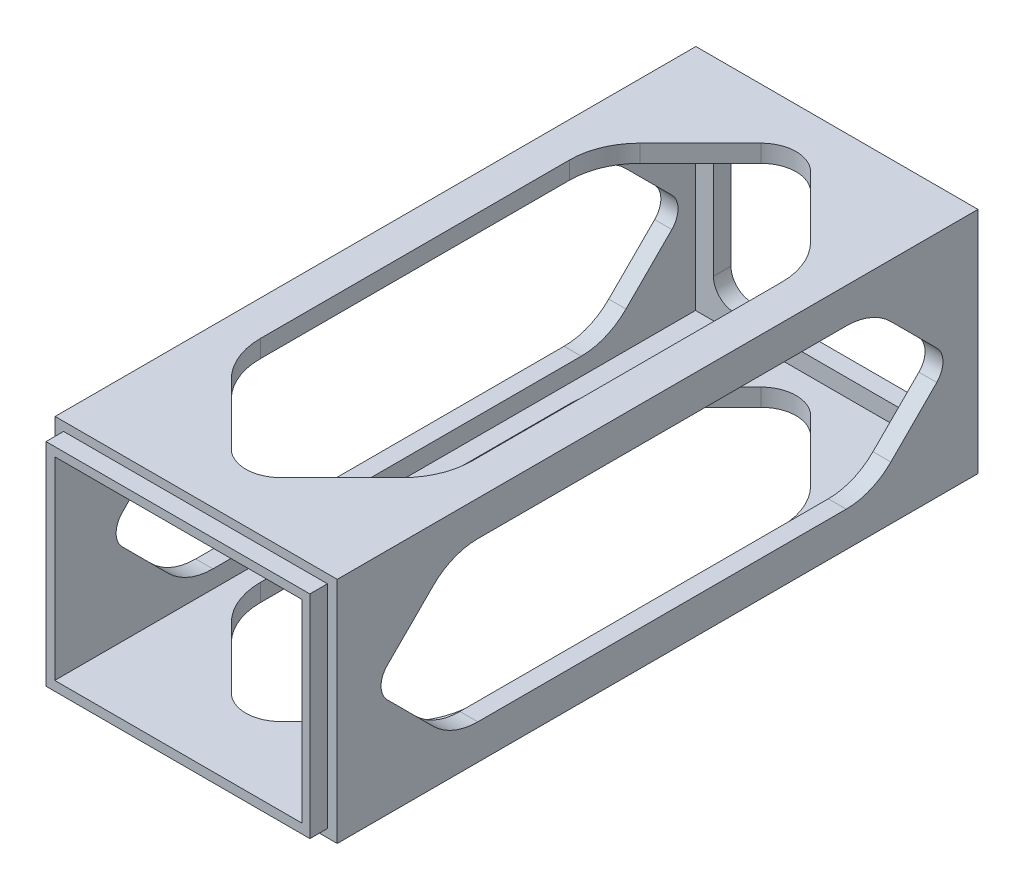
from build123d import *

# Parameters (mm, degrees)
SKETCH2_W           = 44.704
SKETCH2_H           = 35.052
BOSS_EXTRUDE1_DEPTH = 119.126
SKETCH4_W           = 51.054
SKETCH4_H           = 41.402
SKETCH4_W_2         = 47.752
SKETCH4_H_2         = 38.354
BOSS_EXTRUDE2_DEPTH = 115.951
SKETCH5_W           = 51.054
SKETCH5_H           = 41.402
BOSS_EXTRUDE3_DEPTH = 3.175
CUT_EXTRUDE1_DEPTH  = 6.35
CUT_EXTRUDE2_DEPTH  = 132.811951465
CUT_EXTRUDE3_DEPTH  = 130.93059219


with BuildPart() as part:
    # Sketch2 → Boss-Extrude1 (new body)
    with BuildSketch(Plane.XY):
        Polygon((-29.730268616, 22.430738007), (18.021731384, 22.430738007), (18.021731384, -15.923261993), (-29.730268616, -15.923261993), (-29.730268616, -15.068411042), align=None)
        with Locations((-5.790768616, 3.317238007)):
            Rectangle(SKETCH2_W, SKETCH2_H, mode=Mode.SUBTRACT)
    extrude(amount=BOSS_EXTRUDE1_DEPTH)

    # Sketch4 → Boss-Extrude2 (add)
    with BuildSketch(Plane(origin=(0, 0, 0), x_dir=(-1, 0, 0), z_dir=(0, 0, -1))):
        with Locations((5.727268616, 3.317238007)):
            Rectangle(SKETCH4_W, SKETCH4_H)
        with Locations((5.854268616, 3.253738007)):
            Rectangle(SKETCH4_W_2, SKETCH4_H_2, mode=Mode.SUBTRACT)
    extrude(amount=-BOSS_EXTRUDE2_DEPTH)

    # Sketch5 → Boss-Extrude3 (add)
    with BuildSketch(Plane(origin=(0, 0, 0), x_dir=(-1, 0, 0), z_dir=(0, 0, -1))):
        with Locations((5.727268616, 3.317238007)):
            Rectangle(SKETCH5_W, SKETCH5_H)
    extrude(amount=-BOSS_EXTRUDE3_DEPTH)

    # Sketch6 → Cut-Extrude1 (cut)
    with BuildSketch(Plane.XY.offset(3.175)):
        with BuildLine():
            Line((-21.094268616, 17.668238007), (9.639731384, 17.668238007))
            ThreePointArc((9.639731384, 17.668238007), (12.33380822, 16.552314843), (13.449731384, 13.858238007))
            Line((13.449731384, 13.858238007), (13.449731384, -7.223761993))
            ThreePointArc((13.449731384, -7.223761993), (12.33380822, -9.91783883), (9.639731384, -11.033761993))
            Line((9.639731384, -11.033761993), (-21.094268616, -11.033761993))
            ThreePointArc((-21.094268616, -11.033761993), (-23.788345453, -9.91783883), (-24.904268616, -7.223761993))
            Line((-24.904268616, -7.223761993), (-24.904268616, 13.858238007))
            ThreePointArc((-24.904268616, 13.858238007), (-23.788345453, 16.552314843), (-21.094268616, 17.668238007))
        make_face()
    extrude(amount=-CUT_EXTRUDE1_DEPTH, mode=Mode.SUBTRACT)

    # Sketch7 → Cut-Extrude2 (cut, through all)
    with BuildSketch(Plane.ZY.offset(-19.799731384)):
        with BuildLine():
            Line((23.847961018, -11.033761993), (90.515538982, -11.033761993))
            ThreePointArc((90.515538982, -11.033761993), (94.889610614, -10.16370505), (98.597769491, -7.685992502))
            Line((98.597769491, -7.685992502), (106.906923164, 0.62316117))
            ThreePointArc((106.906923164, 0.62316117), (108.022846327, 3.317238007), (106.906923164, 6.011314843))
            Line((106.906923164, 6.011314843), (98.597769491, 14.320468515))
            ThreePointArc((98.597769491, 14.320468515), (94.889610614, 16.798181063), (90.515538982, 17.668238007))
            Line((90.515538982, 17.668238007), (23.847961018, 17.668238007))
            ThreePointArc((23.847961018, 17.668238007), (19.473889386, 16.798181063), (15.765730509, 14.320468515))
            Line((15.765730509, 14.320468515), (7.456576836, 6.011314843))
            ThreePointArc((7.456576836, 6.011314843), (6.340653673, 3.317238007), (7.456576836, 0.62316117))
            Line((7.456576836, 0.62316117), (15.765730509, -7.685992502))
            ThreePointArc((15.765730509, -7.685992502), (19.473889386, -10.16370505), (23.847961018, -11.033761993))
        make_face()
    extrude(amount=CUT_EXTRUDE2_DEPTH, mode=Mode.SUBTRACT)

    # Sketch8 → Cut-Extrude3 (cut, through all)
    with BuildSketch(Plane(origin=(0, 24.018238007, 0), x_dir=(1, 0, 0), z_dir=(0, 1, 0))):
        with BuildLine():
            Line((9.729987505, -20.219756121), (-1.237140556, -9.252628061))
            ThreePointArc((-1.237140556, -9.252628061), (-5.727268616, -7.392756121), (-10.217396677, -9.252628061))
            Line((-10.217396677, -9.252628061), (-21.184524737, -20.219756121))
            ThreePointArc((-21.184524737, -20.219756121), (-23.937538679, -24.339932651), (-24.904268616, -29.200012242))
            Line((-24.904268616, -29.200012242), (-24.904268616, -85.163487758))
            ThreePointArc((-24.904268616, -85.163487758), (-23.937538679, -90.023567349), (-21.184524737, -94.143743879))
            Line((-21.184524737, -94.143743879), (-10.217396677, -105.110871939))
            ThreePointArc((-10.217396677, -105.110871939), (-5.727268616, -106.970743879), (-1.237140556, -105.110871939))
            Line((-1.237140556, -105.110871939), (9.729987505, -94.143743879))
            ThreePointArc((9.729987505, -94.143743879), (12.483001447, -90.023567349), (13.449731384, -85.163487758))
            Line((13.449731384, -85.163487758), (13.449731384, -29.200012242))
            ThreePointArc((13.449731384, -29.200012242), (12.483001447, -24.339932651), (9.729987505, -20.219756121))
        make_face()
    extrude(amount=-CUT_EXTRUDE3_DEPTH, mode=Mode.SUBTRACT)


solid = part.part
